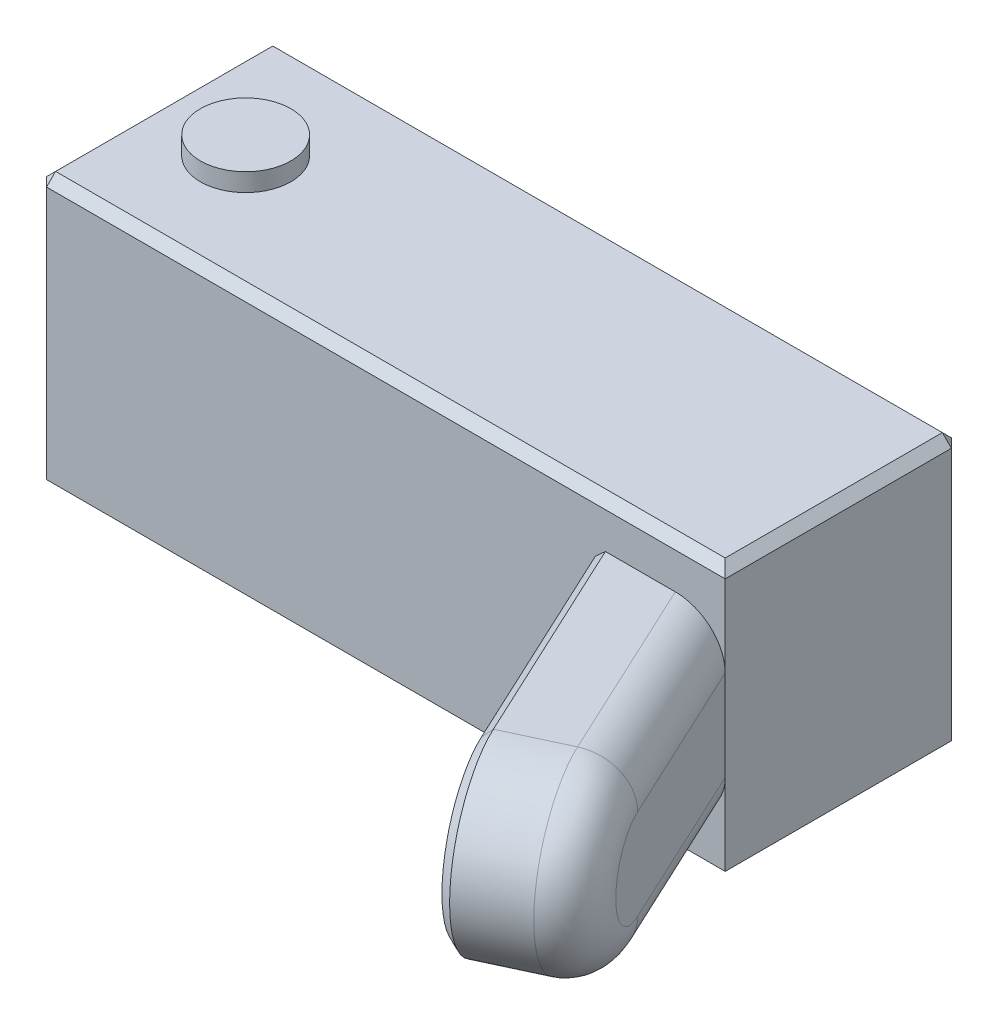
from build123d import *

# Parameters (mm, degrees)
BOSS_EXTRUDE1_DEPTH      = 15
BOSS_EXTRUDE1_DEPTH_BACK = 15
SKETCH1_W                = 76
SKETCH1_H                = 26
BOSS_EXTRUDE2_DEPTH      = 13
BOSS_EXTRUDE3_REACH      = 66.525
SKETCH3_W                = 13
SKETCH3_H                = 20
FILLET1_R                = 5
CHAMFER1_SIZE            = 1
SKETCH4_R                = 5
BOSS_EXTRUDE4_DEPTH      = 2


with BuildPart() as part:
    # Sketch1 → Boss-Extrude1 (new, two sides: drawn at the far end of the back side and taken through both)
    with BuildSketch(Plane(origin=(0, 0, 0), x_dir=(1, 0, 0), z_dir=(0, 1, 0)).offset(-BOSS_EXTRUDE1_DEPTH_BACK)):
        Rectangle(SKETCH1_W, SKETCH1_H)
    extrude(amount=BOSS_EXTRUDE1_DEPTH + BOSS_EXTRUDE1_DEPTH_BACK)

    # Sketch3 → Boss-Extrude3 (add, up to next)
    with BuildSketch(Plane(origin=(11.766324296, 0, 25.232963882), x_dir=(-0.9063077870366482, 0, 0.4226182617407034), z_dir=(-0.4226182617407034, 0, -0.9063077870366482)), mode=Mode.PRIVATE) as boss_extrude3_sk1:
        with Locations((-22.445658505, 0)):
            Rectangle(SKETCH3_W, SKETCH3_H)
    boss_extrude3_tool1 = extrude(boss_extrude3_sk1.sketch, amount=BOSS_EXTRUDE3_REACH, mode=Mode.PRIVATE) - part.part


with BuildPart() as body_2:
    # Sketch2 → Boss-Extrude2 (new body)
    with BuildSketch(Plane(origin=(26.233675704, 0, -12.232963882), x_dir=(0, 1, 0), z_dir=(-0.9063077870366482, 0, 0.42261826174070327))):
        with BuildLine():
            Line((10, -27.841495178), (-10, -27.841495178))
            Line((-10, -27.841495178), (-10, -47.841495178))
            ThreePointArc((-10, -47.841495178), (0, -57.841495178), (10, -47.841495178))
            Line((10, -47.841495178), (10, -27.841495178))
        make_face()
    extrude(amount=BOSS_EXTRUDE2_DEPTH)


with BuildPart() as part_1:
    add(part.part)

    add(body_2.part)  # Boss-Extrude3 merges body 2
    add(boss_extrude3_tool1.solids().sort_by_distance((32.108999, 0, 15.747019))[0])

    # Fillet1
    fillet1_edges = [part_1.edges().sort_by_distance(p)[0] for p in [
        (42.226182617, -10, 22.06307787),
        (42.226182617, 10, 22.06307787),
        (50.678547852, 0, 40.189233611),
    ]]
    fillet(fillet1_edges, radius=FILLET1_R)

    # Chamfer1
    chamfer1_edges = [part_1.edges().sort_by_distance(p)[0] for p in [
        (29.163225528, -10, 24.810096572),
        (38.896546621, 0, 45.683271014),
        (29.163225528, 10, 24.810096572),
        (0, -15, -13),
        (0, -15, 13),
        (38, -15, 0),
        (-38, -15, 0),
        (-38, 0, -13),
        (-38, 0, 13),
        (0, 15, 13),
        (-38, 15, 0),
        (0, 15, -13),
        (38, 15, 0),
        (38, 0, -13),
    ]]
    chamfer(chamfer1_edges, length=CHAMFER1_SIZE)

    # Sketch4 → Boss-Extrude4 (add)
    with BuildSketch(Plane(origin=(0, 15, 0), x_dir=(1, 0, 0), z_dir=(0, 1, 0))):
        with Locations((-28, 0)):
            Circle(SKETCH4_R)
    extrude(amount=BOSS_EXTRUDE4_DEPTH)


solid = part_1.part
